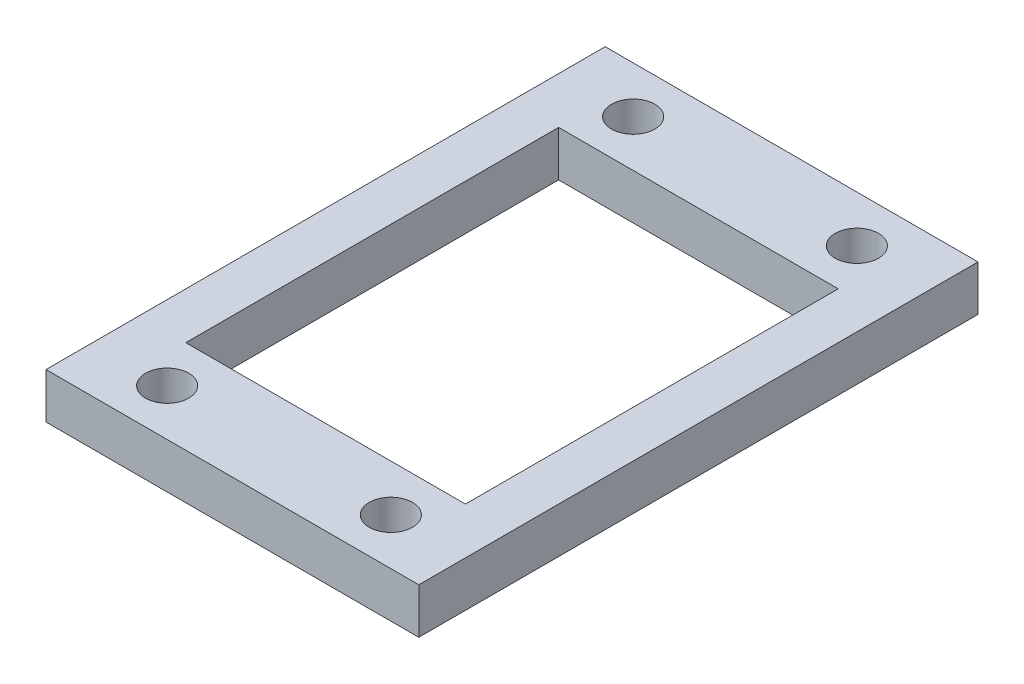
from build123d import *

# Parameters (mm, degrees)
SKETCH1_W           = 25.4
SKETCH1_H           = 38.1
SKETCH1_R           = 1.4732
SKETCH1_W_2         = 19.05
SKETCH1_H_2         = 25.4
BOSS_EXTRUDE1_DEPTH = 3.0988


with BuildPart() as part:
    # Sketch1 → Boss-Extrude1 (new body)
    with BuildSketch(Plane(origin=(0, 0, 0), x_dir=(1, 0, 0), z_dir=(0, 1, 0))):
        with Locations((-12.7, 0)):
            Rectangle(SKETCH1_W, SKETCH1_H)
        with Locations(Location((-5.08, 15.875, 0), (0, 0, 270))):
            Circle(SKETCH1_R, mode=Mode.SUBTRACT)
        with Locations(Location((-20.32, -15.875, 0), (0, 0, 270))):
            Circle(SKETCH1_R, mode=Mode.SUBTRACT)
        with Locations(Location((-20.32, 15.875, 0), (0, 0, 90))):
            Circle(SKETCH1_R, mode=Mode.SUBTRACT)
        with Locations(Location((-5.08, -15.875, 0), (0, 0, 90))):
            Circle(SKETCH1_R, mode=Mode.SUBTRACT)
        with Locations((-12.7, 0)):
            Rectangle(SKETCH1_W_2, SKETCH1_H_2, mode=Mode.SUBTRACT)
    extrude(amount=BOSS_EXTRUDE1_DEPTH)


solid = part.part
